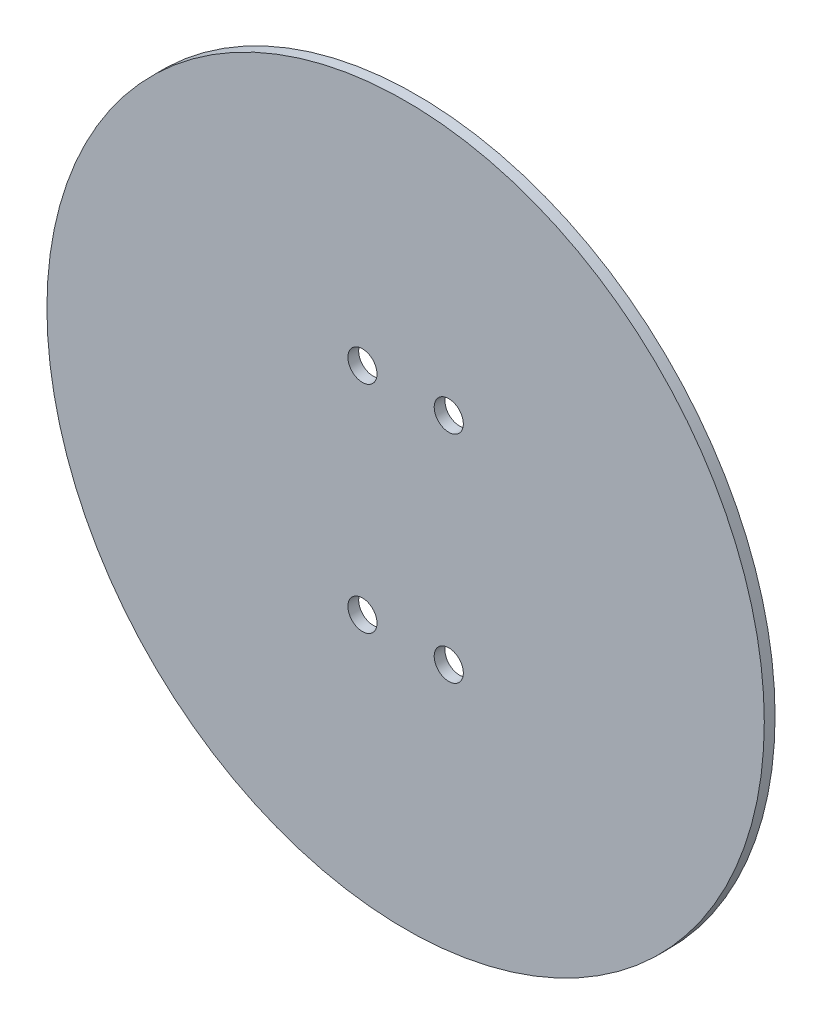
from build123d import *

# Parameters (mm, degrees)
SKETCH1_R           = 84.455
BOSS_EXTRUDE1_DEPTH = 2.54
SKETCH2_R           = 3.429
CUT_EXTRUDE1_DEPTH  = 2.54


with BuildPart() as part:
    # Sketch1 → Boss-Extrude1 (new body)
    with BuildSketch(Plane.XY):
        Circle(SKETCH1_R)
    extrude(amount=BOSS_EXTRUDE1_DEPTH)

    # Sketch2 → Cut-Extrude1 (cut)
    with BuildSketch(Plane.XY.offset(2.54)):
        with Locations((-10.16, 25.4)):
            Circle(SKETCH2_R)
        with Locations(Location((10.16, 25.4, 0), (0, 0, 180))):
            Circle(SKETCH2_R)
        with Locations((10.16, -25.4)):
            Circle(SKETCH2_R)
        with Locations(Location((-10.16, -25.4, 0), (0, 0, 180))):
            Circle(SKETCH2_R)
    extrude(amount=-CUT_EXTRUDE1_DEPTH, mode=Mode.SUBTRACT)


solid = part.part
